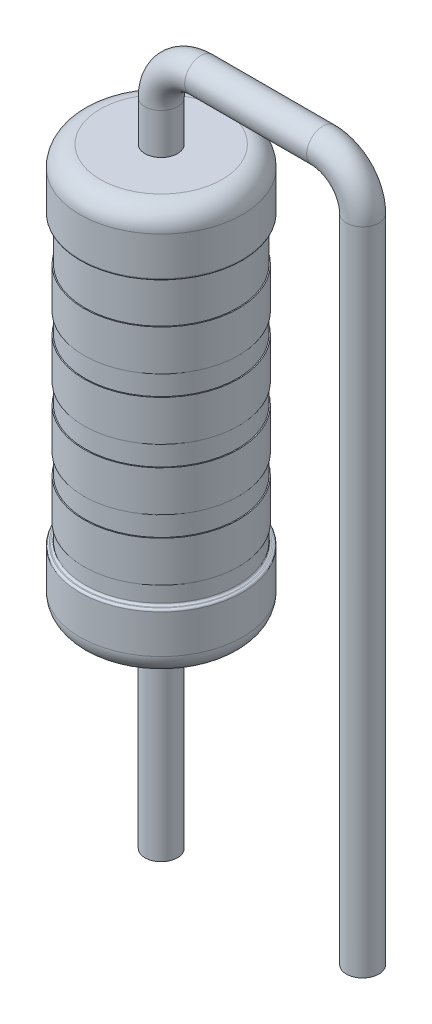
from build123d import *

# Parameters (mm, degrees)
ESQUISSE2_R        = 0.4
BOSS_EXTRU_1_DEPTH = 5
ESQUISSE3_R        = 0.4
ESQUISSE5_W        = 0.05
ESQUISSE5_H        = 1


with BuildPart() as part:
    # Esquisse1 → Révolution1 (revolve)
    with BuildSketch(Plane.XY, mode=Mode.PRIVATE) as r_volution1_sk:
        with BuildLine():
            Line((-2, 3.55), (-2, 4.5))
            ThreePointArc((-2, 4.5), (-1.853553391, 4.853553391), (-1.5, 5))
            Line((-1.5, 5), (0, 5))
            Line((0, 5), (0, -5))
            Line((0, -5), (-1.5, -5))
            ThreePointArc((-1.5, -5), (-1.853553391, -4.853553391), (-2, -4.5))
            Line((-2, -4.5), (-2, -3.55))
            ThreePointArc((-2, -3.55), (-1.985355339, -3.514644661), (-1.95, -3.5))
            Line((-1.95, -3.5), (-1.925, -3.5))
            ThreePointArc((-1.925, -3.5), (-1.889644661, -3.485355339), (-1.875, -3.45))
            Line((-1.875, -3.45), (-1.875, 3.45))
            ThreePointArc((-1.875, 3.45), (-1.889644661, 3.485355339), (-1.925, 3.5))
            Line((-1.925, 3.5), (-1.95, 3.5))
            ThreePointArc((-1.95, 3.5), (-1.985355339, 3.514644661), (-2, 3.55))
        make_face()
    revolve(r_volution1_sk.sketch.rotate(Axis((0, 5, 0), (0, -1, 0)), 270), axis=Axis((0, 5, 0), (0, -1, 0)))

    # Esquisse2 → Boss.-Extru.1 (add)
    with BuildSketch(Plane.XZ.offset(5)):
        with Locations(Location((0, 0, 0), (0, 0, 270))):
            Circle(ESQUISSE2_R)
    extrude(amount=BOSS_EXTRU_1_DEPTH)

    # Balayage1: sweep along a path in Esquisse4
    with BuildLine(Plane.XY) as balayage1_path:
        Line((-0.022890051, 5), (-0.022890051, 6))
        ThreePointArc((-0.022890051, 6), (0.270003168, 6.707106781), (0.977109949, 7))
        Line((0.977109949, 7), (3.977109949, 7))
        ThreePointArc((3.977109949, 7), (4.68421673, 6.707106781), (4.977109949, 6))
        Line((4.977109949, 6), (4.977109949, -10))
    # Esquisse3 → Balayage1 (sweep)
    with BuildSketch(Plane(origin=(0, 5, 0), x_dir=(1, 0, 0), z_dir=(0, 1, 0))):
        Circle(ESQUISSE3_R)
    sweep(path=balayage1_path.line)

    # Esquisse5 → Révolution2 (revolve)
    with BuildSketch(Plane.XY, mode=Mode.PRIVATE) as r_volution2_sk:
        with Locations((-1.875, 1.95)):
            Rectangle(ESQUISSE5_W, ESQUISSE5_H)
        with Locations((-1.875, 0.45)):
            Rectangle(ESQUISSE5_W, ESQUISSE5_H)
        with Locations((-1.875, -1.05)):
            Rectangle(ESQUISSE5_W, ESQUISSE5_H)
        with Locations((-1.875, -2.55)):
            Rectangle(ESQUISSE5_W, ESQUISSE5_H)
    revolve(r_volution2_sk.sketch.rotate(Axis((0, 5.026578042, 0), (0, -1, 0)), 270), axis=Axis((0, 5.026578042, 0), (0, -1, 0)))


solid = part.part
